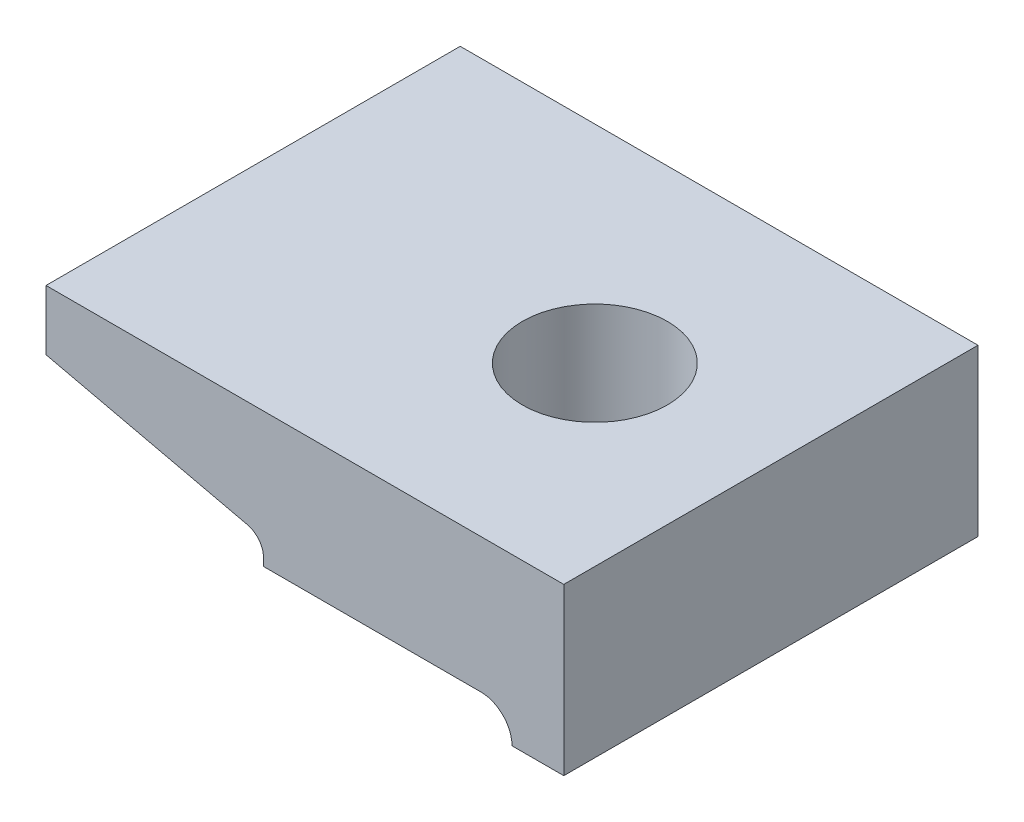
from build123d import *

# Parameters (mm, degrees)
EXTRUDE_1_DEPTH     = 20
SKETCH_2_R          = 7
CUT_EXTRUDE_1_DEPTH = 83.097503007


with BuildPart() as part:
    # ｽｹｯﾁ1 → ﾎﾞｽ - 押し出し1 (new, symmetric)
    with BuildSketch(Plane.XY):
        with BuildLine():
            Line((73, 0), (78, 0))
            Line((78, 0), (78, 16))
            Line((78, 16), (28, 16))
            Line((28, 16), (28, 10.205732014))
            Line((28, 10.205732014), (47.449902109, 5.715368296))
            ThreePointArc((47.449902109, 5.715368296), (48.565216314, 5.01165744), (49, 3.766628167))
            Line((49, 3.766628167), (49, 3))
            Line((49, 3), (70, 3))
            ThreePointArc((70, 3), (72.121320344, 2.121320344), (73, 0))
        make_face()
    extrude(amount=EXTRUDE_1_DEPTH, both=True)

    # ｽｹｯﾁ2 → ｶｯﾄ - 押し出し1 (cut, through all)
    with BuildSketch(Plane(origin=(0, 16, 0), x_dir=(1, 0, 0), z_dir=(0, 1, 0))):
        with Locations(Location((61, 0, 0), (0, 0, 180))):
            Circle(SKETCH_2_R)
    extrude(amount=-CUT_EXTRUDE_1_DEPTH, mode=Mode.SUBTRACT)


solid = part.part
